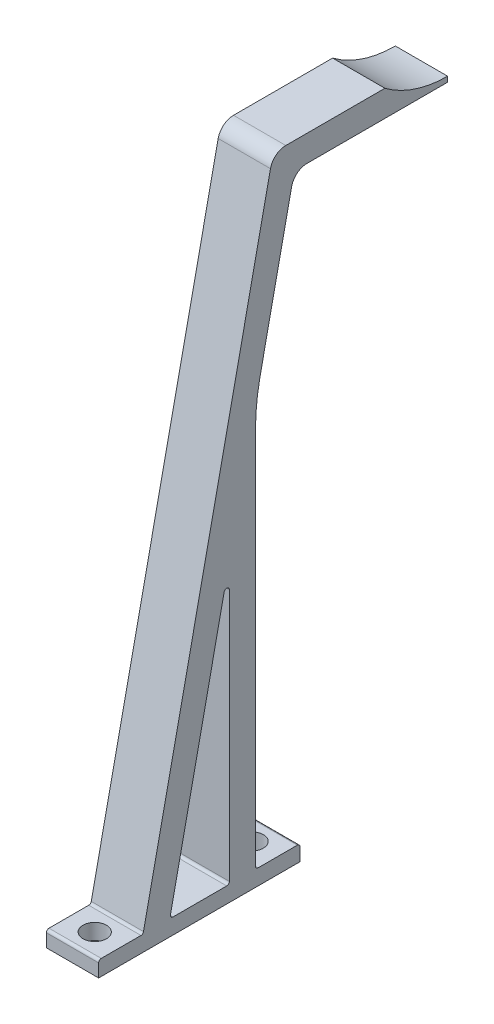
from build123d import *

# Parameters (mm, degrees)
BOSS_EXTRUDE1_DEPTH = 10
SKETCH1_5_OUTSIDE_W = 96.286
SKETCH1_5_OUTSIDE_H = 149.536
CUT_EXTRUDE2_DEPTH  = 10
SKETCH5_R           = 2.25
CUT_EXTRUDE3_DEPTH  = 10


with BuildPart() as part:
    # Sketch1 → Boss-Extrude1 (new body)
    with BuildSketch(Plane(origin=(0, 0, 0), x_dir=(0, 0, -1), z_dir=(1, 0, 0))):
        with BuildLine():
            Line((19.39483456, 104.718712665), (-4.885010669, -9.508978253))
            ThreePointArc((-4.885010669, -9.508978253), (-5.059424274, -9.793595388), (-5.374084469, -9.905022408))
            Line((-5.374084469, -9.905022408), (-12.969192453, -9.905022408))
            ThreePointArc((-12.969192453, -9.905022408), (-13.322745843, -10.051469017), (-13.469192453, -10.405022408))
            Line((-13.469192453, -10.405022408), (-13.469192453, -12.905022408))
            Line((-13.469192453, -12.905022408), (25.030807547, -12.905022408))
            Line((25.030807547, -12.905022408), (25.030807547, -10.405022408))
            ThreePointArc((25.030807547, -10.405022408), (24.884360938, -10.051469017), (24.530807547, -9.905022408))
            Line((24.530807547, -9.905022408), (17.030807547, -9.905022408))
            ThreePointArc((17.030807547, -9.905022408), (16.677254157, -9.758575798), (16.530807547, -9.405022408))
            Line((16.530807547, -9.405022408), (16.530807547, 62.991683812))
            ThreePointArc((16.530807547, 62.991683812), (16.749931733, 67.172822342), (17.404903518, 71.308151444))
            Line((17.404903518, 71.308151444), (23.443754726, 99.718712665))
            ThreePointArc((23.443754726, 99.718712665), (24.490236355, 101.426415477), (26.378197528, 102.094977592))
            Line((26.378197528, 102.094977592), (53.280807547, 102.094977592))
            Line((53.280807547, 102.094977592), (53.280807547, 103.094977592))
            ThreePointArc((53.280807547, 103.094977592), (46.956252227, 104.121311631), (41.280807547, 107.094977592))
            Line((41.280807547, 107.094977592), (22.329277362, 107.094977592))
            ThreePointArc((22.329277362, 107.094977592), (20.441316189, 106.426415477), (19.39483456, 104.718712665))
        make_face()
    extrude(amount=BOSS_EXTRUDE1_DEPTH)

    # Sketch1<5> outside → Cut-Extrude2 (cut)
    # profile 1 of 2: a face of its own
    with BuildSketch(Plane(origin=(0, 0, 0), x_dir=(0, 0, -1), z_dir=(1, 0, 0))):
        with Locations((19.906, 47.095)):
            Rectangle(SKETCH1_5_OUTSIDE_W, SKETCH1_5_OUTSIDE_H)
        with BuildLine():
            Line((19.39483456, 104.718712665), (-4.885010669, -9.508978253))
            ThreePointArc((-4.885010669, -9.508978253), (-5.059424274, -9.793595388), (-5.374084469, -9.905022408))
            Line((-5.374084469, -9.905022408), (-12.969192453, -9.905022408))
            ThreePointArc((-12.969192453, -9.905022408), (-13.322745843, -10.051469017), (-13.469192453, -10.405022408))
            Line((-13.469192453, -10.405022408), (-13.469192453, -12.905022408))
            Line((-13.469192453, -12.905022408), (25.030807547, -12.905022408))
            Line((25.030807547, -12.905022408), (25.030807547, -10.405022408))
            ThreePointArc((25.030807547, -10.405022408), (24.884360938, -10.051469017), (24.530807547, -9.905022408))
            Line((24.530807547, -9.905022408), (17.030807547, -9.905022408))
            ThreePointArc((17.030807547, -9.905022408), (16.677254157, -9.758575798), (16.530807547, -9.405022408))
            Line((16.530807547, -9.405022408), (16.530807547, 62.991683812))
            ThreePointArc((16.530807547, 62.991683812), (16.749931733, 67.172822342), (17.404903518, 71.308151444))
            Line((17.404903518, 71.308151444), (23.443754726, 99.718712665))
            ThreePointArc((23.443754726, 99.718712665), (24.490236355, 101.426415477), (26.378197528, 102.094977592))
            Line((26.378197528, 102.094977592), (53.280807547, 102.094977592))
            Line((53.280807547, 102.094977592), (53.280807547, 103.094977592))
            ThreePointArc((53.280807547, 103.094977592), (46.956252227, 104.121311631), (41.280807547, 107.094977592))
            Line((41.280807547, 107.094977592), (22.329277362, 107.094977592))
            ThreePointArc((22.329277362, 107.094977592), (20.441316189, 106.426415477), (19.39483456, 104.718712665))
        make_face(mode=Mode.SUBTRACT)
    # profile 2 of 2: a face of its own
    with BuildSketch(Plane(origin=(0, 0, 0), x_dir=(0, 0, -1), z_dir=(1, 0, 0))):
        with BuildLine():
            Line((0.7599591, -9.905022408), (11.030807547, -9.905022408))
            ThreePointArc((11.030807547, -9.905022408), (11.384360938, -9.758575798), (11.530807547, -9.405022408))
            Line((11.530807547, -9.405022408), (11.530807547, 38.915520448))
            ThreePointArc((11.530807547, 38.915520448), (11.083071779, 39.412781396), (10.541733747, 39.019476293))
            Line((10.541733747, 39.019476293), (0.2708853, -9.301066562))
            ThreePointArc((0.2708853, -9.301066562), (0.371386119, -9.719682603), (0.7599591, -9.905022408))
        make_face()
    extrude(amount=CUT_EXTRUDE2_DEPTH, mode=Mode.SUBTRACT)

    # Sketch5 → Cut-Extrude3 (cut)
    with BuildSketch(Plane.XZ.offset(12.905022408)):
        with Locations((5, 9.219192453)):
            Circle(SKETCH5_R)
        with Locations((5, -20.780807547)):
            Circle(SKETCH5_R)
    extrude(amount=-CUT_EXTRUDE3_DEPTH, mode=Mode.SUBTRACT)


solid = part.part
